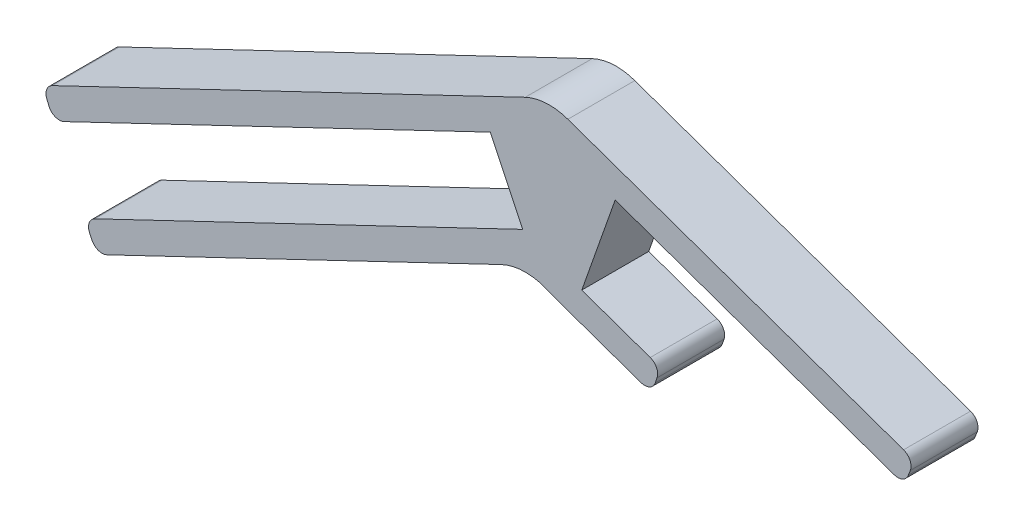
from build123d import *

# Parameters (mm, degrees)
EXTRUDE_1_DEPTH = 12
FILLET_1_R      = 10
FILLET_2_R      = 10
FILLET_5_R      = 2
FILLET_6_R      = 2


with BuildPart() as part:
    # 草圖1 → 填料-伸長1 (new body)
    with BuildSketch(Plane.XY):
        Polygon((-89.273265788, -29.922645798), (0.928558352, 13.247145977), (66.944140174, -10.032522336), (65.138238425, -14.697469577), (13.313992743, 3.577780247), (7.327792319, -13.397655079), (21.473988424, -18.386155432), (19.835061436, -23.109984484), (4.845229239, -17.823985149), (-3.252616127, -14.806615195), (-79.583485532, -51.337891248), (-81.717667186, -46.81616648), (-3.242080184, -9.258447635), (-9.070002074, 2.918798623), (-87.320597555, -34.531241278), align=None)
    extrude(amount=EXTRUDE_1_DEPTH)

    # 圓角1
    fillet_1_edges = [part.edges().sort_by_distance(p)[0] for p in [
        (0.928558352, 13.247145977, 6),
    ]]
    fillet(fillet_1_edges, radius=FILLET_1_R)

    # 圓角2
    fillet_2_edges = [part.edges().sort_by_distance(p)[0] for p in [
        (-3.252616127, -14.806615195, 6),
    ]]
    fillet(fillet_2_edges, radius=FILLET_2_R)

    # 圓角5
    fillet_5_edges = [part.edges().sort_by_distance(p)[0] for p in [
        (65.138238425, -14.697469577, 6),
        (21.473988424, -18.386155432, 6),
        (19.835061436, -23.109984484, 6),
        (66.944140174, -10.032522336, 6),
    ]]
    fillet(fillet_5_edges, radius=FILLET_5_R)

    # 圓角6
    fillet_6_edges = [part.edges().sort_by_distance(p)[0] for p in [
        (-79.583485532, -51.337891248, 6),
        (-81.717667186, -46.81616648, 6),
        (-87.320597555, -34.531241278, 6),
        (-89.273265788, -29.922645798, 6),
    ]]
    fillet(fillet_6_edges, radius=FILLET_6_R)


solid = part.part
